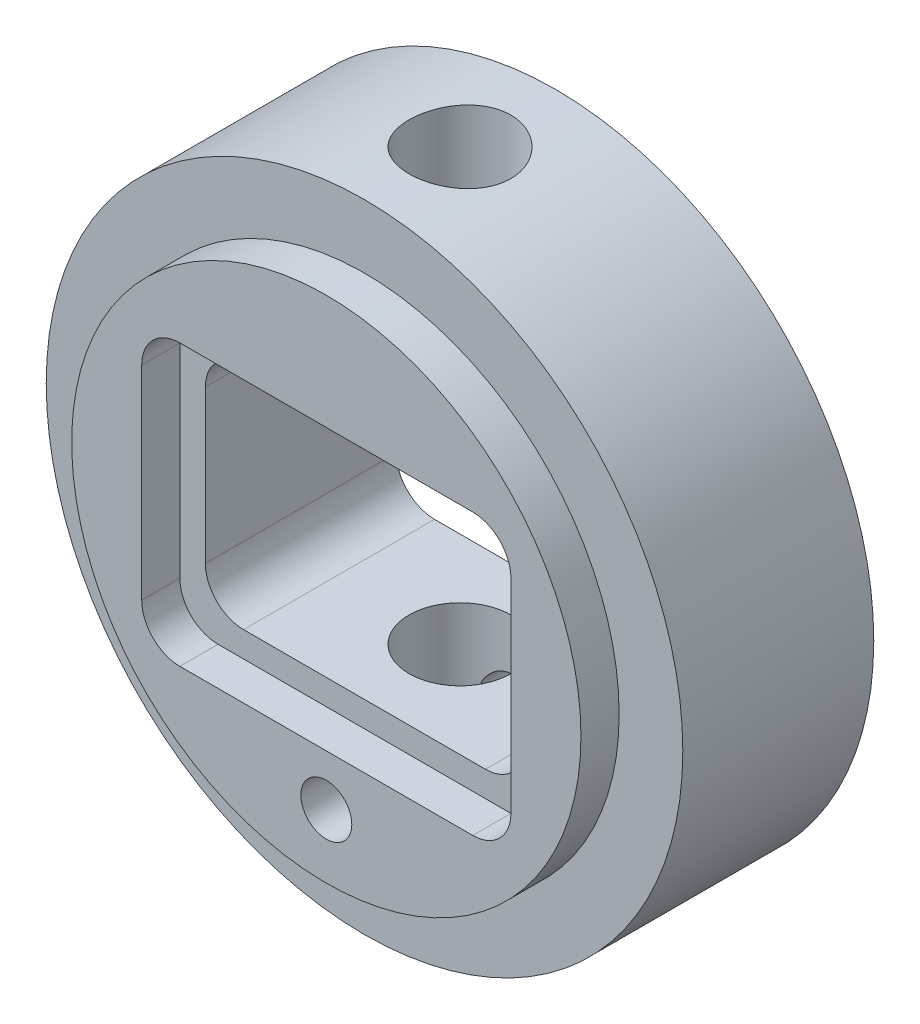
from build123d import *

# Parameters (mm, degrees)
SKETCH1_R                 = 25
SKETCH1_W                 = 25
SKETCH1_H                 = 18
BOSS_EXTRUDE1_DEPTH       = 15
SKETCH2_R                 = 20
SKETCH2_W                 = 29
SKETCH2_H                 = 22
BOSS_EXTRUDE2_DEPTH       = 3
F_4_0MM_DOWEL_HOLE1_D     = 4
F_8_0MM_DOWEL_HOLE1_D     = 8
F_8_0MM_DOWEL_HOLE1_DEPTH = 16
F_8_0MM_DOWEL_HOLE2_D     = 8
FILLET1_R                 = 3


with BuildPart() as part:
    # Sketch1 → Boss-Extrude1 (new body)
    with BuildSketch(Plane.XY):
        Circle(SKETCH1_R)
        Rectangle(SKETCH1_W, SKETCH1_H, mode=Mode.SUBTRACT)
    extrude(amount=BOSS_EXTRUDE1_DEPTH)

    # Sketch2 → Boss-Extrude2 (add)
    with BuildSketch(Plane.XY.offset(15)):
        Circle(SKETCH2_R)
        Rectangle(SKETCH2_W, SKETCH2_H, mode=Mode.SUBTRACT)
    extrude(amount=BOSS_EXTRUDE2_DEPTH)

    # Ø4.0mm Dowel Hole1 (through all)
    with Locations(Plane.XY.offset(18)):
        with Locations((0, -15)):
            Hole(F_4_0MM_DOWEL_HOLE1_D / 2)

    # Ø8.0mm Dowel Hole1
    with Locations(Plane(origin=(0, 9, 0), x_dir=(-1, 0, 0), z_dir=(0, -1, 0))):
        with Locations((0, -7.5)):
            Hole(F_8_0MM_DOWEL_HOLE1_D / 2, depth=F_8_0MM_DOWEL_HOLE1_DEPTH)

    # Ø8.0mm Dowel Hole2 (through all)
    with Locations(Plane(origin=(0, -9, 0), x_dir=(1, 0, 0), z_dir=(0, 1, 0))):
        with Locations((0, -7.5)):
            Hole(F_8_0MM_DOWEL_HOLE2_D / 2)

    # Fillet1
    fillet1_edges = [part.edges().sort_by_distance(p)[0] for p in [
        (14.5, 11, 16.5),
        (-14.5, 11, 16.5),
        (-14.5, -11, 16.5),
        (14.5, -11, 16.5),
        (-12.5, 9, 7.5),
        (-12.5, -9, 7.5),
        (12.5, -9, 7.5),
        (12.5, 9, 7.5),
    ]]
    fillet(fillet1_edges, radius=FILLET1_R)


solid = part.part
